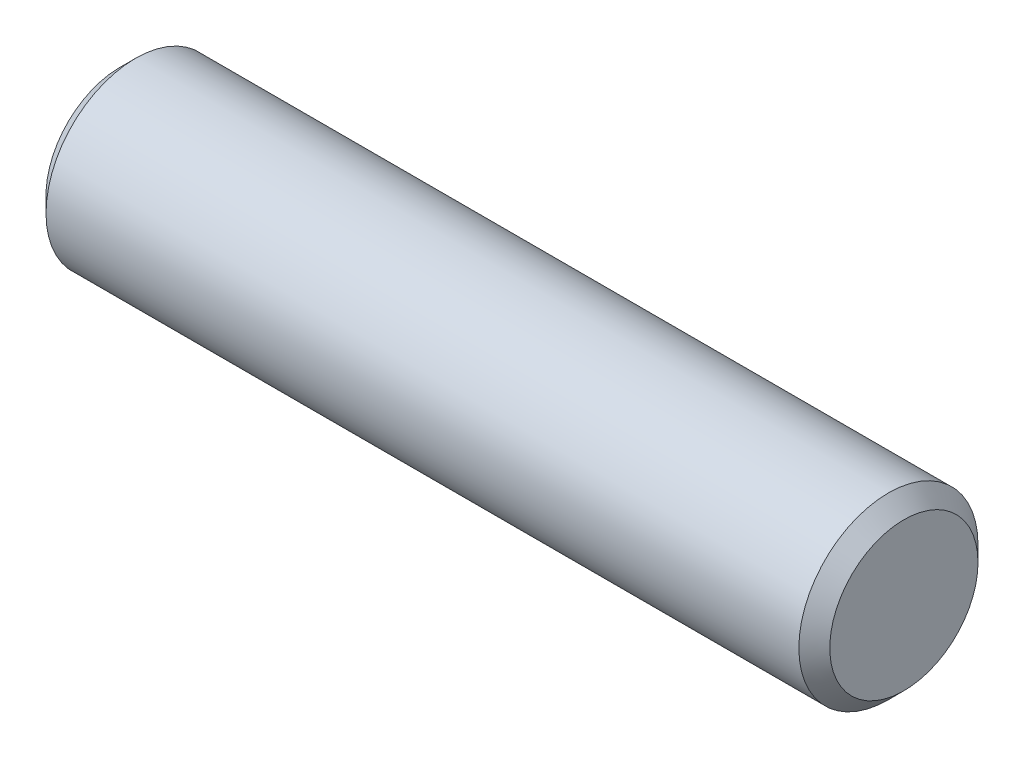
from build123d import *

# Parameters (mm, degrees)
BODYSKE_W     = 35
BODYSKE_H     = 4
CHAMFER1_SIZE = 0.6905


with BuildPart() as part:
    # BodySke → BaseBody (revolve)
    with BuildSketch(Plane.XY, mode=Mode.PRIVATE) as basebody_sk:
        with Locations((17.5, 2)):
            Rectangle(BODYSKE_W, BODYSKE_H)
    revolve(basebody_sk.sketch.rotate(Axis((-3.175, 0, 0), (1, 0, 0)), 90), axis=Axis((-3.175, 0, 0), (1, 0, 0)))

    # Chamfer1
    chamfer1_edges = [part.edges().sort_by_distance(p)[0] for p in [
        (35, 0, -4),
        (0, 0, -4),
    ]]
    chamfer(chamfer1_edges, length=CHAMFER1_SIZE)


solid = part.part
